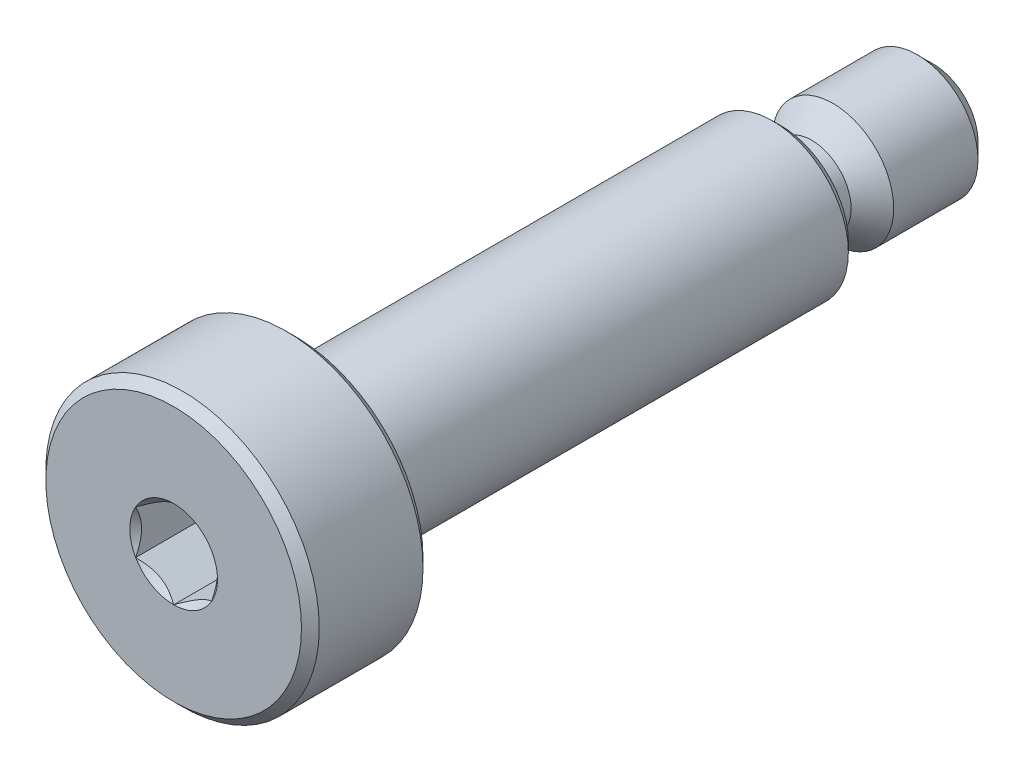
from build123d import *

# Parameters (mm, degrees)
CUT_EXTRUDE1_START = 12.5
CUT_EXTRUDE1_DEPTH = 2
CHAMFER1_SIZE      = 0.2925


with BuildPart() as part:
    # Sketch3 → Revolve1 (revolve)
    with BuildSketch(Plane(origin=(0, 0, 0), x_dir=(0, 0, -1), z_dir=(1, 0, 0)), mode=Mode.PRIVATE) as revolve1_sk:
        with BuildLine():
            Line((-12.5, 0), (-12.5, 4.2075))
            Line((-12.5, 4.2075), (-12.2075, 4.5))
            Line((-12.2075, 4.5), (-8.7925, 4.5))
            Line((-8.7925, 4.5), (-8.5, 4.2075))
            Line((-8.5, 4.2075), (-8.5, 2.297))
            Line((-8.5, 2.297), (-7.992, 2.297))
            Line((-7.992, 2.297), (-7.789, 2.5))
            Line((-7.789, 2.5), (7.5, 2.5))
            Line((7.5, 2.5), (7.5, 1.65))
            ThreePointArc((7.5, 1.65), (7.602512627, 1.402512627), (7.85, 1.3))
            Line((7.85, 1.3), (8.5, 1.3))
            Line((8.5, 1.3), (9.2, 2))
            Line((9.2, 2), (11.975, 2))
            Line((11.975, 2), (12.5, 1.475))
            Line((12.5, 1.475), (12.5, 0))
            Line((12.5, 0), (-12.5, 0))
        make_face()
    revolve(revolve1_sk.sketch.rotate(Axis((0, 0, 12.5), (0, 0, -1)), 90), axis=Axis((0, 0, 12.5), (0, 0, -1)))

    # Sketch4 → Cut-Extrude1 (cut)
    with BuildSketch(Plane.XY.offset(CUT_EXTRUDE1_START)):
        Polygon((0, 1.443375673), (-1.25, 0.721687836), (-1.25, -0.721687836), (0, -1.443375673), (1.25, -0.721687836), (1.25, 0.721687836), align=None)
    extrude(amount=-CUT_EXTRUDE1_DEPTH, mode=Mode.SUBTRACT)

    # Cut-Extrude2 cone 1 section (through the dimple's axis) → Cut-Extrude2 (revolve, cut)
    with BuildSketch(Plane(origin=(0, 0, 12.5), x_dir=(0, -1, 0), z_dir=(1, 0, 0))):
        Polygon((0, 0), (1.443375673, 0), (0, 1.443375673), align=None)
    revolve(axis=Axis((0, 0, 12.5), (0, 0, -1)), mode=Mode.SUBTRACT)

    # Chamfer1
    chamfer1_edges = [part.edges().sort_by_distance(p)[0] for p in [
        (-2.5, 0, -7.5),
    ]]
    chamfer(chamfer1_edges, length=CHAMFER1_SIZE)


solid = part.part
